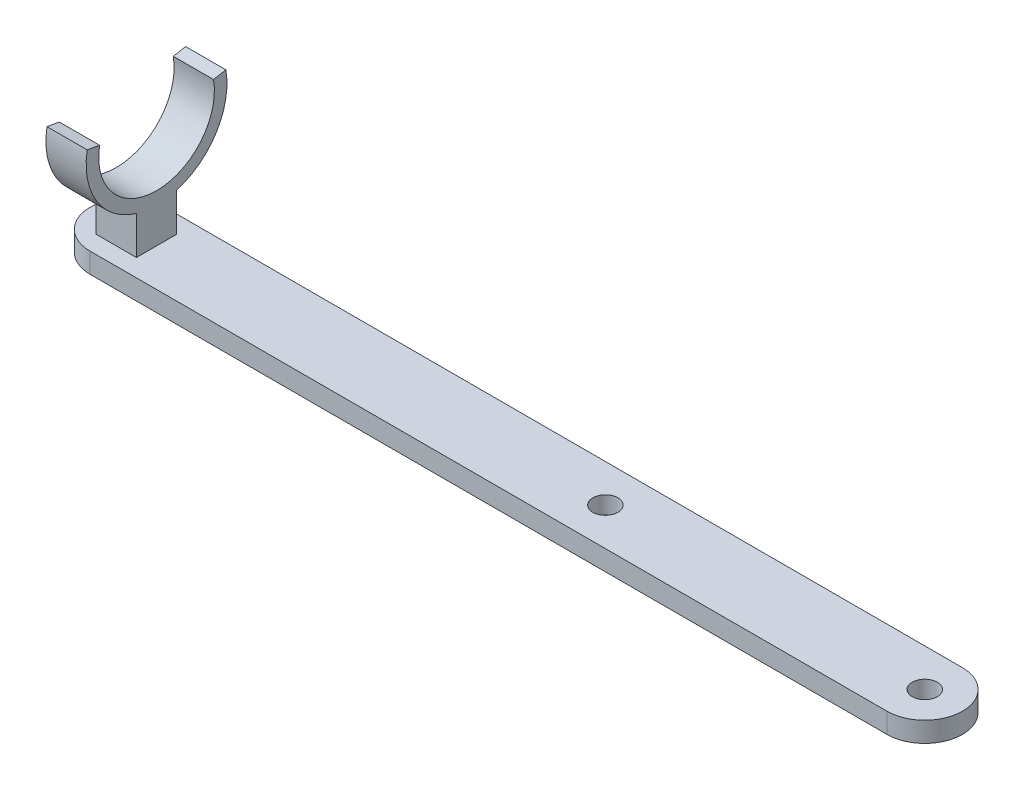
from build123d import *

# Parameters (mm, degrees)
SKETCH2_R                = 2.5
BOSS_EXTRUDE1_DEPTH      = 4
BOSS_EXTRUDE2_DEPTH      = 4
BOSS_EXTRUDE2_DEPTH_BACK = 4
BOSS_EXTRUDE3_REACH      = 138.997
BOSS_EXTRUDE3_END_RADIUS = 14
SKETCH4_W                = 8
SKETCH4_H                = 8
SKETCH5_R                = 5.4
CUT_EXTRUDE1_DEPTH       = 0.5


with BuildPart() as part:
    # Sketch2 → Boss-Extrude1 (new body)
    with BuildSketch(Plane(origin=(0, 0, 0), x_dir=(1, 0, 0), z_dir=(0, 1, 0))):
        with BuildLine():
            Line((-126.75, 7.5), (31.75, 7.5))
            ThreePointArc((31.75, 7.5), (39.25, 0), (31.75, -7.5))
            Line((31.75, -7.5), (-126.75, -7.5))
            ThreePointArc((-126.75, -7.5), (-134.25, 0), (-126.75, 7.5))
        make_face()
        with Locations((-31.75, 0)):
            Circle(SKETCH2_R, mode=Mode.SUBTRACT)
        with Locations((31.75, 0)):
            Circle(SKETCH2_R, mode=Mode.SUBTRACT)
    extrude(amount=BOSS_EXTRUDE1_DEPTH)



with BuildPart() as body_2:
    # Sketch3 → Boss-Extrude2 (new, two sides: drawn at the far end of the back side and taken through both)
    with BuildSketch(Plane(origin=(-125, 0, 0), x_dir=(0, 0, -1), z_dir=(1, 0, 0)).offset(-BOSS_EXTRUDE2_DEPTH_BACK)):
        with BuildLine():
            Line((-13.787308542, 27.431074487), (-11.32528916, 26.996954043))
            ThreePointArc((-11.32528916, 26.996954043), (0, 13.5), (11.32528916, 26.996954043))
            Line((11.32528916, 26.996954043), (13.787308542, 27.431074487))
            ThreePointArc((13.787308542, 27.431074487), (0, 11), (-13.787308542, 27.431074487))
        make_face()
    extrude(amount=BOSS_EXTRUDE2_DEPTH + BOSS_EXTRUDE2_DEPTH_BACK)


with BuildPart() as part_1:
    add(part.part)

    add(body_2.part)  # Boss-Extrude3 merges body 2
    # Boss-Extrude3: up to this cylinder (the profile starts outside it)
    boss_extrude3_end = Plane(origin=(-125, 25, 0), z_dir=(1, 0, 0)) * Cylinder(BOSS_EXTRUDE3_END_RADIUS, 306.994, mode=Mode.PRIVATE)
    # Sketch4 → Boss-Extrude3 (add, up to the surface)
    with BuildSketch(Plane(origin=(0, 4, 0), x_dir=(1, 0, 0), z_dir=(0, 1, 0)), mode=Mode.PRIVATE) as boss_extrude3_sk1:
        with Locations((-125, 0)):
            Rectangle(SKETCH4_W, SKETCH4_H)
    boss_extrude3_tool1 = extrude(boss_extrude3_sk1.sketch, amount=BOSS_EXTRUDE3_REACH, mode=Mode.PRIVATE) - boss_extrude3_end
    add(boss_extrude3_tool1.solids().sort_by_distance((-125, 4, 0))[0])

    # Sketch5 → Cut-Extrude1 (cut)
    with BuildSketch(Plane.XZ):
        with Locations((-31.75, 0)):
            Circle(SKETCH5_R)
        with Locations((31.75, 0)):
            Circle(SKETCH5_R)
    extrude(amount=-CUT_EXTRUDE1_DEPTH, mode=Mode.SUBTRACT)


solid = part_1.part
